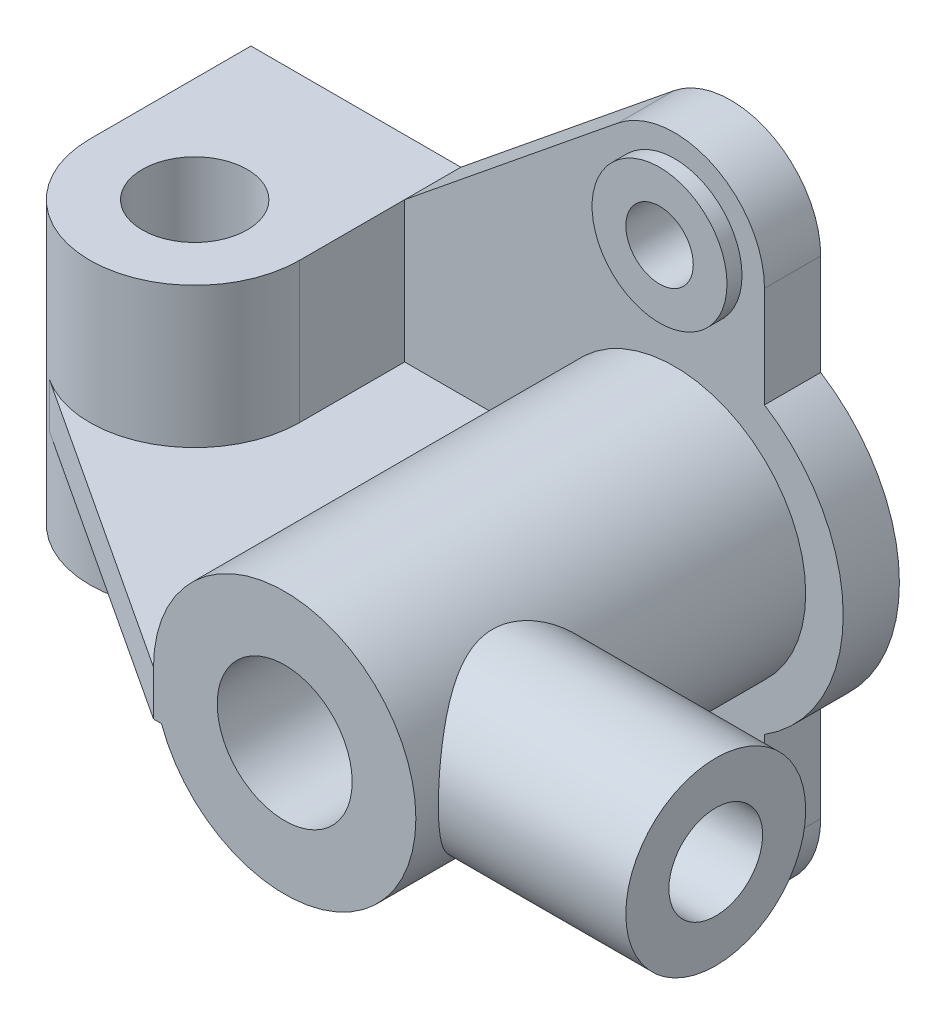
from build123d import *

# Parameters (mm, degrees)
SKETCH1_R                       = 35
SKETCH1_R_2                     = 18
BOSS_EXTRUDE1_DEPTH             = 15
SKETCH1_4_R                     = 18
SKETCH1_4_R_2                   = 9
BOSS_EXTRUDE2_DEPTH             = 19
SKETCH1_5_R                     = 35
SKETCH1_5_R_2                   = 18
BOSS_EXTRUDE3_DEPTH             = 119
BOSS_EXTRUDE4_REACH             = 230.059
SKETCH2_R                       = 14
BOSS_EXTRUDE4_DIRECTION_2_REACH = 230.059
BOSS_EXTRUDE5_START             = -12
BOSS_EXTRUDE5_DEPTH             = 12
BOSS_EXTRUDE7_REACH             = 443.059
BOSS_EXTRUDE7_END_RADIUS        = 35
BOSS_EXTRUDE7_START             = -213
SKETCH4_R                       = 24
SKETCH4_R_2                     = 12.5
CUT_EXTRUDE1_REACH              = 474.713
CUT_EXTRUDE1_END_RADIUS         = 18
CUT_EXTRUDE1_START              = -213
SKETCH4_3_R                     = 12.5


with BuildPart() as part:
    # Sketch1 → Boss-Extrude1 (new body)
    with BuildSketch(Plane.XY):
        with BuildLine():
            Line((0, -37.5), (56, -37.5))
            Line((56, -37.5), (112.880924764, -83.639033344))
            ThreePointArc((112.880924764, -83.639033344), (138.323327815, -86.666308011), (152, -65))
            Line((152, -65), (152, -38.065732621))
            ThreePointArc((152, -38.065732621), (173, 0), (152, 38.065732621))
            Line((152, 38.065732621), (152, 65))
            ThreePointArc((152, 65), (138.323327815, 86.666308011), (112.880924764, 83.639033344))
            Line((112.880924764, 83.639033344), (56, 37.5))
            Line((56, 37.5), (0, 37.5))
            Line((0, 37.5), (0, -37.5))
        make_face()
        with Locations((128, 0)):
            Circle(SKETCH1_R, mode=Mode.SUBTRACT)
        with Locations((128, -65)):
            Circle(SKETCH1_R_2, mode=Mode.SUBTRACT)
        with Locations((128, 65)):
            Circle(SKETCH1_R_2, mode=Mode.SUBTRACT)
    extrude(amount=BOSS_EXTRUDE1_DEPTH)

    # Sketch1<4> → Boss-Extrude2 (add)
    # profile 1 of 2: a face of its own
    with BuildSketch(Plane.XY):
        with Locations((128, 65)):
            Circle(SKETCH1_4_R)
        with Locations((128, 65)):
            Circle(SKETCH1_4_R_2, mode=Mode.SUBTRACT)
    # profile 2 of 2: a face of its own
    with BuildSketch(Plane.XY):
        with Locations((128, -65)):
            Circle(SKETCH1_4_R)
        with Locations((128, -65)):
            Circle(SKETCH1_4_R_2, mode=Mode.SUBTRACT)
    extrude(amount=BOSS_EXTRUDE2_DEPTH)

    # Sketch1<5> → Boss-Extrude3 (add)
    with BuildSketch(Plane.XY):
        with Locations((128, 0)):
            Circle(SKETCH1_5_R)
        with Locations((128, 0)):
            Circle(SKETCH1_5_R_2, mode=Mode.SUBTRACT)
    extrude(amount=BOSS_EXTRUDE3_DEPTH)

    # Boss-Extrude4: up to this face of the body (flat: up to its plane)
    boss_extrude4_end = Plane(part.part.faces().sort_by_distance((28, 37.5, 7.5))[0])
    # Sketch2 → Boss-Extrude4 (add, up to the picked face)
    with BuildSketch(Plane(origin=(0, 0, 0), x_dir=(1, 0, 0), z_dir=(0, 1, 0)), mode=Mode.PRIVATE) as boss_extrude4_sk1:
        with BuildLine():
            Line((56, -15), (56, -43))
            ThreePointArc((56, -43), (28, -71), (0, -43))
            Line((0, -43), (0, -15))
            Line((0, -15), (56, -15))
        make_face()
        with Locations((28, -43)):
            Circle(SKETCH2_R, mode=Mode.SUBTRACT)
    boss_extrude4_tool1 = split(extrude(boss_extrude4_sk1.sketch, amount=BOSS_EXTRUDE4_REACH, mode=Mode.PRIVATE), bisect_by=boss_extrude4_end, keep=Keep.BOTH, mode=Mode.PRIVATE)
    add(boss_extrude4_tool1.solids().sort_by(Axis((0.79196, 0, 29), (0, 1, 0)))[0])

    # Boss-Extrude4 direction 2: up to this face of the body (flat: up to its plane)
    boss_extrude4_direction_2_end = Plane(part.part.faces().sort_by_distance((28, -37.5, 7.5))[0])
    # Sketch2 → Boss-Extrude4 direction 2 (add, up to the picked face)
    with BuildSketch(Plane(origin=(0, 0, 0), x_dir=(1, 0, 0), z_dir=(0, 1, 0)), mode=Mode.PRIVATE) as boss_extrude4_direction_2_sk1:
        with BuildLine():
            Line((56, -15), (56, -43))
            ThreePointArc((56, -43), (28, -71), (0, -43))
            Line((0, -43), (0, -15))
            Line((0, -15), (56, -15))
        make_face()
        with Locations((28, -43)):
            Circle(SKETCH2_R, mode=Mode.SUBTRACT)
    boss_extrude4_direction_2_tool1 = split(extrude(boss_extrude4_direction_2_sk1.sketch, amount=-BOSS_EXTRUDE4_DIRECTION_2_REACH, mode=Mode.PRIVATE), bisect_by=boss_extrude4_direction_2_end, keep=Keep.BOTH, mode=Mode.PRIVATE)
    add(boss_extrude4_direction_2_tool1.solids().sort_by(Axis((0.79196, 0, 29), (0, -1, 0)))[0])

    # Sketch3 → Boss-Extrude5 (add)
    with BuildSketch(Plane(origin=(0, 0, 0), x_dir=(1, 0, 0), z_dir=(0, 1, 0)).offset(BOSS_EXTRUDE5_START)):
        with BuildLine():
            Line((93, -119), (12.667624934, -66.42900499))
            ThreePointArc((12.667624934, -66.42900499), (41.317159948, -67.630331929), (56, -43))
            Line((56, -43), (56, -15))
            Line((56, -15), (93, -15))
            Line((93, -15), (110, -15))
            Line((110, -15), (110, -119))
            Line((110, -119), (93, -119))
        make_face()
    extrude(amount=BOSS_EXTRUDE5_DEPTH)

    # Boss-Extrude7: up to this cylinder (the profile starts outside it)
    boss_extrude7_end = Plane(origin=(128, 0, 65.678823), z_dir=(0, 0, -1)) * Cylinder(BOSS_EXTRUDE7_END_RADIUS, 957.118, mode=Mode.PRIVATE)
    # Sketch4 → Boss-Extrude7 (add, up to the surface)
    with BuildSketch(Plane.ZY.offset(BOSS_EXTRUDE7_START), mode=Mode.PRIVATE) as boss_extrude7_sk1:
        with Locations((89, 0)):
            Circle(SKETCH4_R)
        with Locations((89, 0)):
            Circle(SKETCH4_R_2, mode=Mode.SUBTRACT)
    boss_extrude7_tool1 = extrude(boss_extrude7_sk1.sketch, amount=BOSS_EXTRUDE7_REACH, mode=Mode.PRIVATE) - boss_extrude7_end
    add(boss_extrude7_tool1.solids().sort_by_distance((213, 0, 65.678823))[0])

    # Cut-Extrude1: up to this cylinder (the profile starts outside it)
    cut_extrude1_end = Plane(origin=(128, 0, 89), z_dir=(0, 0, -1)) * Cylinder(CUT_EXTRUDE1_END_RADIUS, 986.426, mode=Mode.PRIVATE)
    # Sketch4<3> → Cut-Extrude1 (cut, up to the surface)
    with BuildSketch(Plane.ZY.offset(CUT_EXTRUDE1_START), mode=Mode.PRIVATE) as cut_extrude1_sk1:
        with Locations((89, 0)):
            Circle(SKETCH4_3_R)
    cut_extrude1_tool1 = extrude(cut_extrude1_sk1.sketch, amount=CUT_EXTRUDE1_REACH, mode=Mode.PRIVATE) - cut_extrude1_end
    add(cut_extrude1_tool1.solids().sort_by_distance((213, 0, 89))[0], mode=Mode.SUBTRACT)


solid = part.part
